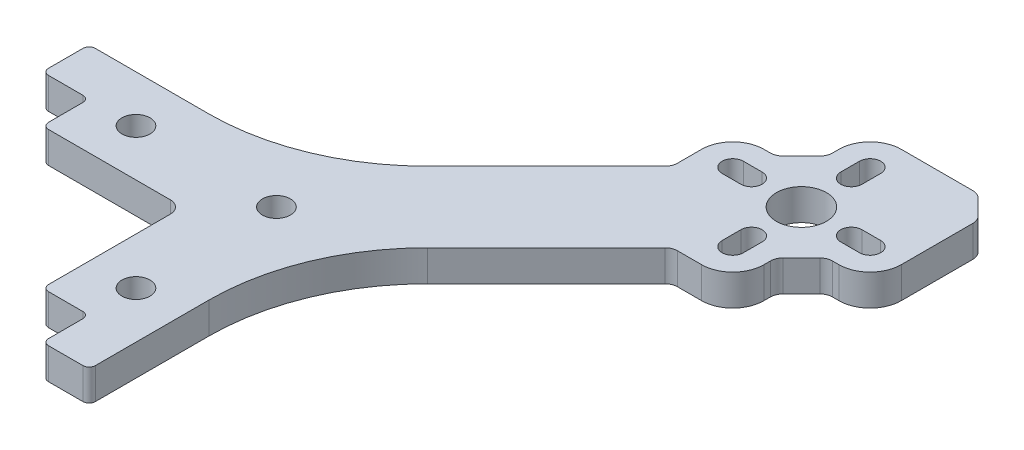
from build123d import *

# Parameters (mm, degrees)
SKETCH1_R                = 4
BOSS_EXTRUDE1_DEPTH      = 2.5
FILLET1_R                = 2
FILLET2_R                = 1
M4_CLEARANCE_HOLE1_D     = 4.5
M4_CLEARANCE_HOLE1_DEPTH = 5.2
M4_CLEARANCE_HOLE1_TIP   = 1.351936393


with BuildPart() as part:
    # Sketch1 → Boss-Extrude1 (new, symmetric)
    with BuildSketch(Plane(origin=(0, 0, 0), x_dir=(1, 0, 0), z_dir=(0, 1, 0))):
        with BuildLine():
            Line((95.549512883, 91.833784131), (91.833784131, 95.549512883))
            Line((91.833784131, 95.549512883), (79.549512883, 95.549512883))
            ThreePointArc((79.549512883, 95.549512883), (76.013978978, 94.085046789), (74.549512883, 90.549512883))
            Line((74.549512883, 90.549512883), (74.549512883, 88.691648507))
            Line((74.549512883, 88.691648507), (70.40737726, 84.549512883))
            Line((70.40737726, 84.549512883), (68.549512883, 84.549512883))
            ThreePointArc((68.549512883, 84.549512883), (65.013978978, 83.085046789), (63.549512883, 79.549512883))
            Line((63.549512883, 79.549512883), (63.549512883, 74.863221382))
            Line((63.549512883, 74.863221382), (43.937554159, 55.251262658))
            ThreePointArc((43.937554159, 55.251262658), (32.582736951, 47.664216362), (19.188816818, 45))
            Line((19.188816818, 45), (0, 45))
            Line((0, 45), (0, 37.5))
            Line((0, 37.5), (7.5, 37.5))
            Line((7.5, 37.5), (7.5, 30))
            Line((7.5, 30), (30, 30))
            Line((30, 30), (30, 7.5))
            Line((30, 7.5), (37.5, 7.5))
            Line((37.5, 7.5), (37.5, 0))
            Line((37.5, 0), (45, 0))
            Line((45, 0), (45, 19.188816818))
            ThreePointArc((45, 19.188816818), (47.664216362, 32.582736951), (55.251262658, 43.937554159))
            Line((55.251262658, 43.937554159), (74.863221382, 63.549512883))
            Line((74.863221382, 63.549512883), (79.549512883, 63.549512883))
            ThreePointArc((79.549512883, 63.549512883), (83.085046789, 65.013978978), (84.549512883, 68.549512883))
            Line((84.549512883, 68.549512883), (84.549512883, 70.40737726))
            Line((84.549512883, 70.40737726), (88.691648507, 74.549512883))
            Line((88.691648507, 74.549512883), (90.549512883, 74.549512883))
            ThreePointArc((90.549512883, 74.549512883), (94.085046789, 76.013978978), (95.549512883, 79.549512883))
            Line((95.549512883, 79.549512883), (95.549512883, 91.833784131))
        make_face()
        with Locations(Location((79.549512883, 79.549512883, 0), (0, 0, 270))):
            Circle(SKETCH1_R, mode=Mode.SUBTRACT)
        with BuildLine():
            Line((87.549512883, 81.249512883), (90.549512883, 81.249512883))
            ThreePointArc((90.549512883, 81.249512883), (92.249512883, 79.549512883), (90.549512883, 77.849512883))
            Line((90.549512883, 77.849512883), (87.549512883, 77.849512883))
            ThreePointArc((87.549512883, 77.849512883), (85.849512883, 79.549512883), (87.549512883, 81.249512883))
        make_face(mode=Mode.SUBTRACT)
        with BuildLine():
            Line((81.249512883, 71.549512883), (81.249512883, 68.549512883))
            ThreePointArc((81.249512883, 68.549512883), (79.549512883, 66.849512883), (77.849512883, 68.549512883))
            Line((77.849512883, 68.549512883), (77.849512883, 71.549512883))
            ThreePointArc((77.849512883, 71.549512883), (79.549512883, 73.249512883), (81.249512883, 71.549512883))
        make_face(mode=Mode.SUBTRACT)
        with BuildLine():
            Line((71.549512883, 77.849512883), (68.549512883, 77.849512883))
            ThreePointArc((68.549512883, 77.849512883), (66.849512883, 79.549512883), (68.549512883, 81.249512883))
            Line((68.549512883, 81.249512883), (71.549512883, 81.249512883))
            ThreePointArc((71.549512883, 81.249512883), (73.249512883, 79.549512883), (71.549512883, 77.849512883))
        make_face(mode=Mode.SUBTRACT)
        with BuildLine():
            Line((77.849512883, 87.549512883), (77.849512883, 90.549512883))
            ThreePointArc((77.849512883, 90.549512883), (79.549512883, 92.249512883), (81.249512883, 90.549512883))
            Line((81.249512883, 90.549512883), (81.249512883, 87.549512883))
            ThreePointArc((81.249512883, 87.549512883), (79.549512883, 85.849512883), (77.849512883, 87.549512883))
        make_face(mode=Mode.SUBTRACT)
    extrude(amount=BOSS_EXTRUDE1_DEPTH, both=True)

    # Fillet1
    fillet1_edges = [part.edges().sort_by_distance(p)[0] for p in [
        (91.833784131, 0, -95.549512883),
        (95.549512883, 0, -91.833784131),
        (88.691648507, 0, -74.549512883),
        (84.549512883, 0, -70.40737726),
        (74.863221382, 0, -63.549512883),
        (30, 0, -30),
        (63.549512883, 0, -74.863221382),
        (70.40737726, 0, -84.549512883),
        (74.549512883, 0, -88.691648507),
    ]]
    fillet(fillet1_edges, radius=FILLET1_R)

    # Fillet2
    fillet2_edges = [part.edges().sort_by_distance(p)[0] for p in [
        (45, 0, 0),
        (37.5, 0, 0),
        (37.5, 0, -7.5),
        (30, 0, -7.5),
        (7.5, 0, -30),
        (7.5, 0, -37.5),
        (0, 0, -37.5),
        (0, 0, -45),
    ]]
    fillet(fillet2_edges, radius=FILLET2_R)

    # M4 Clearance Hole1
    with Locations(Plane(origin=(0, 2.5, 0), x_dir=(1, 0, 0), z_dir=(0, 1, 0))):
        with Locations((15, 37.5), (37.5, 15), (37.5, 37.5)):
            Hole(M4_CLEARANCE_HOLE1_D / 2, depth=M4_CLEARANCE_HOLE1_DEPTH)
            with Locations((0, 0, -(M4_CLEARANCE_HOLE1_DEPTH + M4_CLEARANCE_HOLE1_TIP / 2))):  # 118° drill point
                Cone(0, M4_CLEARANCE_HOLE1_D / 2, M4_CLEARANCE_HOLE1_TIP, mode=Mode.SUBTRACT)


solid = part.part
